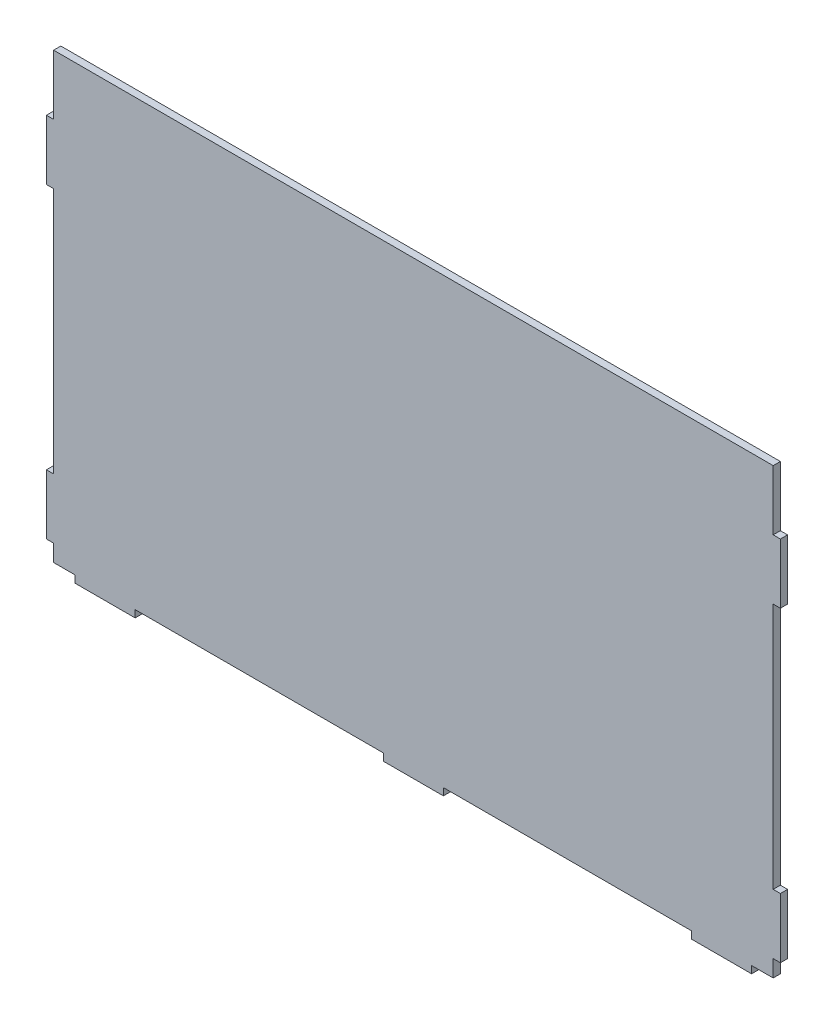
from build123d import *

# Parameters (mm, degrees)
BOSS_EXTRUDE1_DEPTH = 6


with BuildPart() as part:
    # Sketch1 → Boss-Extrude1 (new body)
    with BuildSketch(Plane.XY):
        Polygon((128.964597002, -1027.102908622), (128.964597002, -1021.102908622), (146.964597002, -1021.102908622), (146.964597002, -1007.102908622), (152.964597002, -1007.102908622), (152.964597002, -957.102908622), (146.964597002, -957.102908622), (146.964597002, -751.102908622), (152.964597002, -751.102908622), (152.964597002, -701.102908622), (146.964597002, -701.102908622), (146.964597002, -651.102908622), (-453.035402998, -651.102908622), (-453.035402998, -701.102908622), (-459.035402998, -701.102908622), (-459.035402998, -751.102908622), (-453.035402998, -751.102908622), (-453.035402998, -957.102908622), (-459.035402998, -957.102908622), (-459.035402998, -1007.102908622), (-453.035402998, -1007.102908622), (-453.035402998, -1021.102908622), (-435.035402998, -1021.102908622), (-435.035402998, -1027.102908622), (-385.035402998, -1027.102908622), (-385.035402998, -1021.102908622), (-178.035402998, -1021.102908622), (-178.035402998, -1027.102908622), (-128.035402998, -1027.102908622), (-128.035402998, -1021.102908622), (78.964597002, -1021.102908622), (78.964597002, -1027.102908622), align=None)
    extrude(amount=BOSS_EXTRUDE1_DEPTH)


solid = part.part
